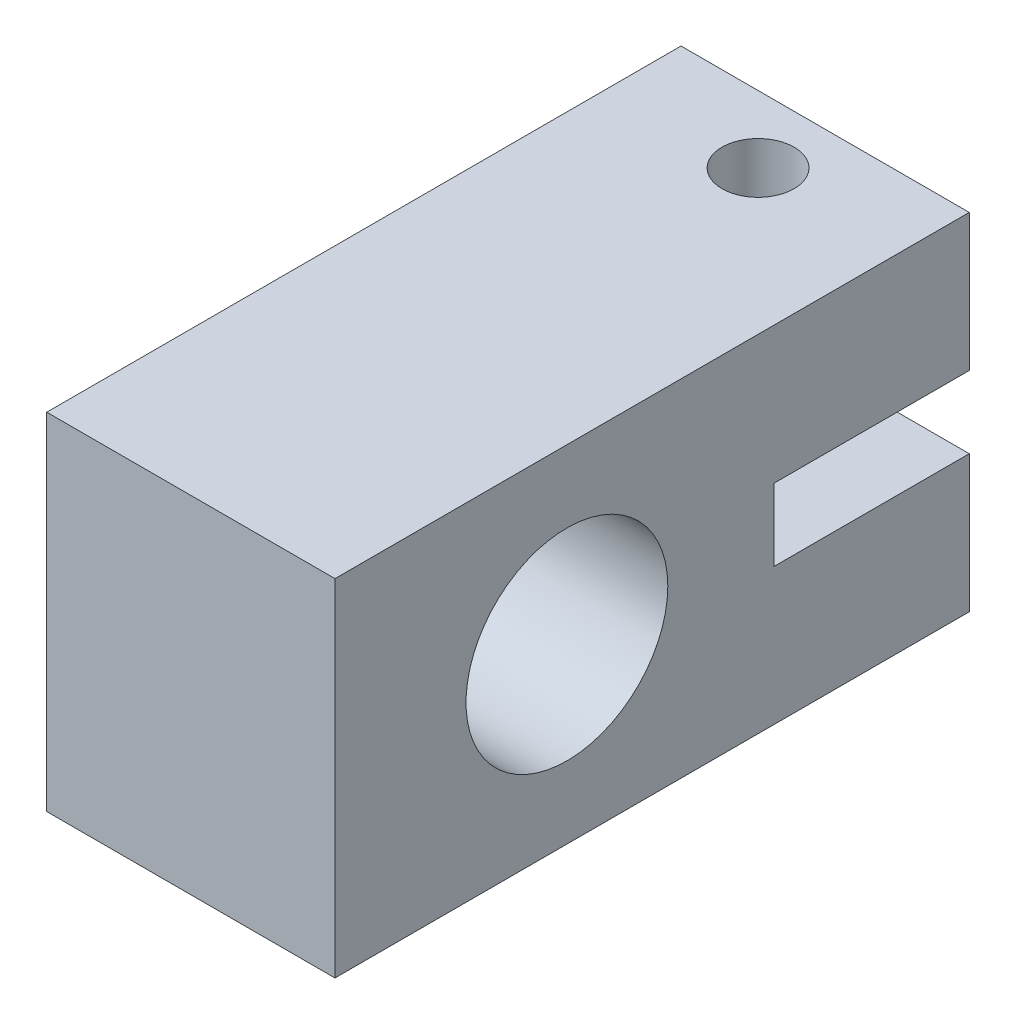
from build123d import *

# Parameters (mm, degrees)
SKETCH_1_R          = 7
EXTRUDE_1_DEPTH     = 20
SKETCH_2_R          = 2.5
CUT_EXTRUDE_2_DEPTH = 42.896701285


with BuildPart() as part:
    # Эскиз1 → Вытянуть1 (new body)
    with BuildSketch(Plane(origin=(0, 0, 0), x_dir=(0, 0, -1), z_dir=(1, 0, 0))):
        Polygon((-16.093397181, 12), (27.91654668, 12), (27.91654668, 2.5), (14.371474957, 2.5), (14.371474957, -2.5), (27.91654668, -2.5), (27.91654668, -12), (-16.093397181, -12), align=None)
        Circle(SKETCH_1_R, mode=Mode.SUBTRACT)
    extrude(amount=EXTRUDE_1_DEPTH)

    # Эскиз2 → Вытянуть2 (cut, through all)
    with BuildSketch(Plane(origin=(0, 12, 0), x_dir=(1, 0, 0), z_dir=(0, 1, 0))):
        with Locations(Location((10, 23.262831067, 0), (0, 0, 270))):
            Circle(SKETCH_2_R)
    extrude(amount=-CUT_EXTRUDE_2_DEPTH, mode=Mode.SUBTRACT)


solid = part.part
